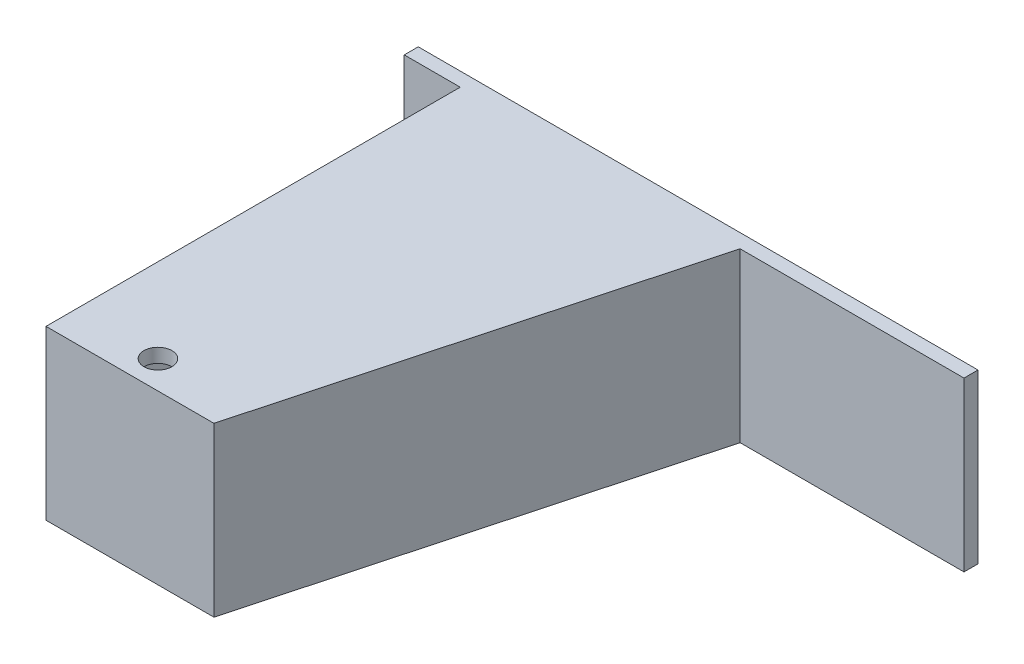
from build123d import *

# Parameters (mm, degrees)
SKETCH1_R           = 3.175
BOSS_EXTRUDE1_DEPTH = 38.1
CUT_EXTRUDE1_START  = -34.925
CUT_EXTRUDE1_DEPTH  = 31.75


with BuildPart() as part:
    # Sketch1 → Boss-Extrude1 (new body)
    with BuildSketch(Plane(origin=(0, 0, 0), x_dir=(1, 0, 0), z_dir=(0, 1, 0))):
        Polygon((-12.7, 97.155), (-12.7, 93.98), (0, 93.98), (0, 0), (38.1, 0), (63.5, 93.98), (114.3, 93.98), (114.3, 97.155), align=None)
        with Locations(Location((19.05, 6.35, 0), (0, 0, 90))):
            Circle(SKETCH1_R, mode=Mode.SUBTRACT)
    extrude(amount=BOSS_EXTRUDE1_DEPTH)

    # Sketch2 → Cut-Extrude1 (cut)
    with BuildSketch(Plane.XZ.offset(CUT_EXTRUDE1_START)):
        Polygon((60.211083077, -97.155), (60.211083077, -93.98), (35.669191185, -3.175), (3.175, -3.175), (3.175, -93.98), (3.175, -97.155), align=None)
    extrude(amount=CUT_EXTRUDE1_DEPTH, mode=Mode.SUBTRACT)


solid = part.part
